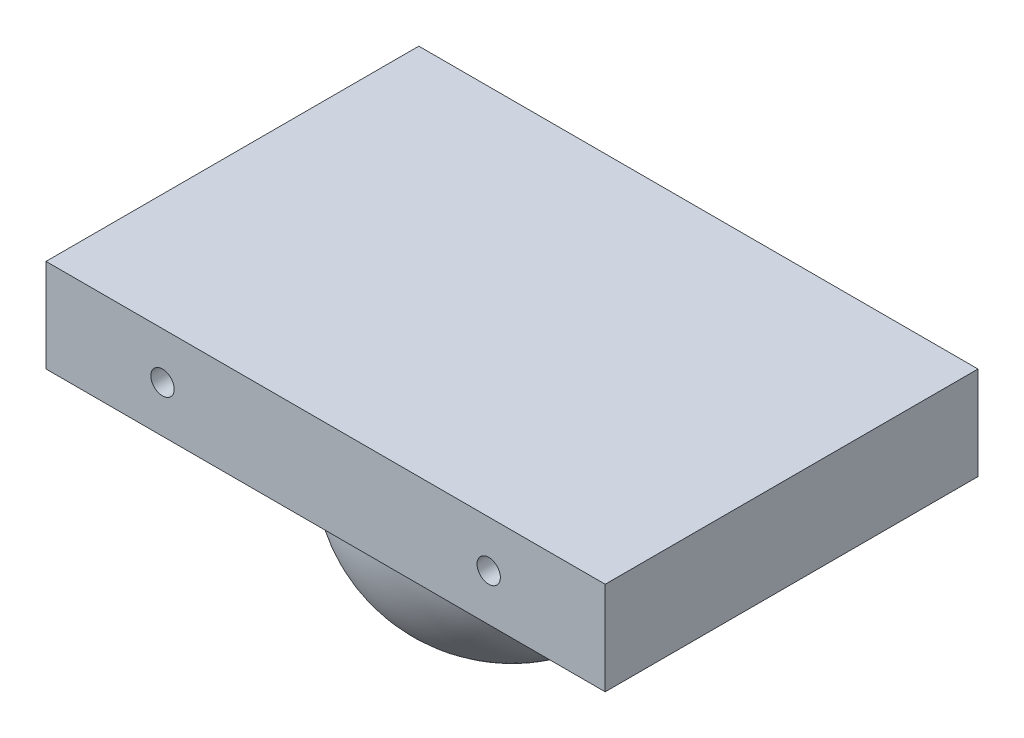
from build123d import *

# Parameters (mm, degrees)
SKETCH2_W           = 30
SKETCH2_H           = 20
BOSS_EXTRUDE2_DEPTH = 5
SKETCH3_R           = 5
BOSS_EXTRUDE3_DEPTH = 2
REVOLVE1_ANGLE      = 180
SKETCH5_R           = 0.625
CUT_EXTRUDE2_DEPTH  = 20


with BuildPart() as part:
    # Sketch2 → Boss-Extrude2 (new body)
    with BuildSketch(Plane(origin=(0, 0, 0), x_dir=(1, 0, 0), z_dir=(0, 1, 0))):
        with Locations((-3.934911243, 0.236686391)):
            Rectangle(SKETCH2_W, SKETCH2_H)
    extrude(amount=BOSS_EXTRUDE2_DEPTH)

    # Sketch3 → Boss-Extrude3 (add)
    with BuildSketch(Plane.XZ):
        with Locations(Location((-3.934911243, -0.236686391, 0), (0, 0, 270))):
            Circle(SKETCH3_R)
    extrude(amount=BOSS_EXTRUDE3_DEPTH)

    # Sketch4 → Revolve1 (revolve)
    with BuildSketch(Plane(origin=(0, -2, 0), x_dir=(-1, 0, 0), z_dir=(0, -1, 0))):
        with BuildLine():
            Line((3.934911243, -7.263313609), (3.934911243, 7.736686391))
            ThreePointArc((3.934911243, 7.736686391), (11.434911243, 0.236686391), (3.934911243, -7.263313609))
        make_face()
    revolve(axis=Axis((-3.934911243, -2, 7.263313609), (0, 0, 1)), revolution_arc=REVOLVE1_ANGLE)

    # Sketch5 → Cut-Extrude2 (cut)
    with BuildSketch(Plane.XY.offset(9.763313609)):
        with Locations((-12.684911243, 2.5)):
            Circle(SKETCH5_R)
        with Locations((4.815088757, 2.5)):
            Circle(SKETCH5_R)
    extrude(amount=-CUT_EXTRUDE2_DEPTH, mode=Mode.SUBTRACT)


solid = part.part
